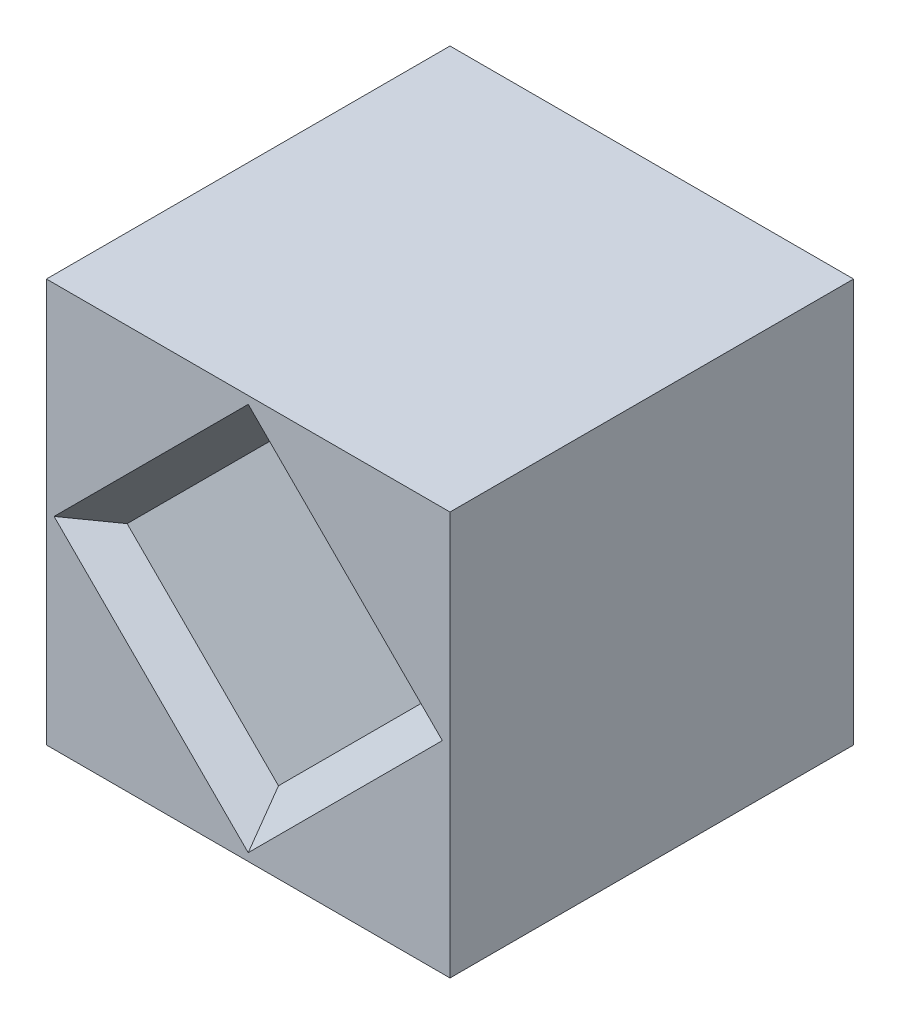
from build123d import *

# Parameters (mm, degrees)
SKETCH1_W           = 8.466666667
SKETCH1_H           = 8.466666667
BOSS_EXTRUDE1_DEPTH = 8.466666667
CUT_EXTRUDE1_DEPTH  = 6.35
CHAMFER1_SIZE       = 0.635


with BuildPart() as part:
    # Sketch1 → Boss-Extrude1 (new body)
    with BuildSketch(Plane(origin=(0, 0, 0), x_dir=(1, 0, 0), z_dir=(0, 1, 0))):
        with Locations((4.233333334, 4.233333334)):
            Rectangle(SKETCH1_W, SKETCH1_H)
    extrude(amount=BOSS_EXTRUDE1_DEPTH)

    # Sketch3 → Cut-Extrude1 (cut)
    with BuildSketch(Plane.XY):
        Polygon((1.058333333, 4.233333333), (4.233333333, 1.058333333), (7.408333333, 4.233333333), (4.233333333, 7.408333333), align=None)
    extrude(amount=-CUT_EXTRUDE1_DEPTH, mode=Mode.SUBTRACT)

    # Chamfer1
    chamfer1_edges = [part.edges().sort_by_distance(p)[0] for p in [
        (2.645833333, 5.820833333, -6.35),
        (5.820833333, 5.820833333, -6.35),
        (5.820833333, 2.645833333, -6.35),
        (2.645833333, 2.645833333, -6.35),
        (2.645833333, 5.820833333, 0),
        (2.645833333, 2.645833333, 0),
        (5.820833333, 2.645833333, 0),
        (5.820833333, 5.820833333, 0),
    ]]
    chamfer(chamfer1_edges, length=CHAMFER1_SIZE)


solid = part.part
